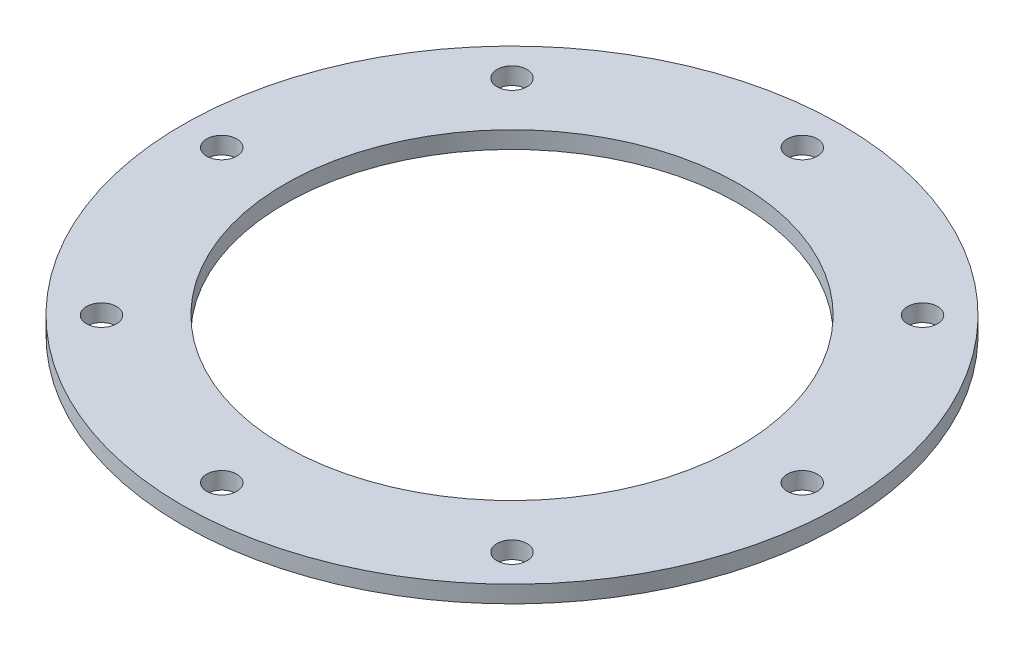
from build123d import *

# Parameters (mm, degrees)
SKETCH_1_R      = 96.5
SKETCH_1_R_2    = 66.5
SKETCH_1_R_3    = 4.4
EXTRUDE_1_DEPTH = 5


with BuildPart() as part:
    # Эскиз1 → Бобышка-Вытянуть1 (new body)
    with BuildSketch(Plane(origin=(0, 0, 0), x_dir=(1, 0, 0), z_dir=(0, 1, 0))):
        with Locations(Location((0, 0, 0), (0, 0, 270))):
            Circle(SKETCH_1_R)
        with Locations(Location((0, 0, 0), (0, 0, 270))):
            Circle(SKETCH_1_R_2, mode=Mode.SUBTRACT)
        with Locations(Location((85, 0, 0), (0, 0, 270))):
            Circle(SKETCH_1_R_3, mode=Mode.SUBTRACT)
        with Locations(Location((60.104076401, -60.104076401, 0), (0, 0, 270))):
            Circle(SKETCH_1_R_3, mode=Mode.SUBTRACT)
        with Locations(Location((0, -85, 0), (0, 0, 270))):
            Circle(SKETCH_1_R_3, mode=Mode.SUBTRACT)
        with Locations(Location((-60.104076401, -60.104076401, 0), (0, 0, 270))):
            Circle(SKETCH_1_R_3, mode=Mode.SUBTRACT)
        with Locations(Location((-85, 0, 0), (0, 0, 270))):
            Circle(SKETCH_1_R_3, mode=Mode.SUBTRACT)
        with Locations(Location((-60.104076401, 60.104076401, 0), (0, 0, 270))):
            Circle(SKETCH_1_R_3, mode=Mode.SUBTRACT)
        with Locations(Location((0, 85, 0), (0, 0, 270))):
            Circle(SKETCH_1_R_3, mode=Mode.SUBTRACT)
        with Locations(Location((60.104076401, 60.104076401, 0), (0, 0, 270))):
            Circle(SKETCH_1_R_3, mode=Mode.SUBTRACT)
    extrude(amount=EXTRUDE_1_DEPTH)


solid = part.part
